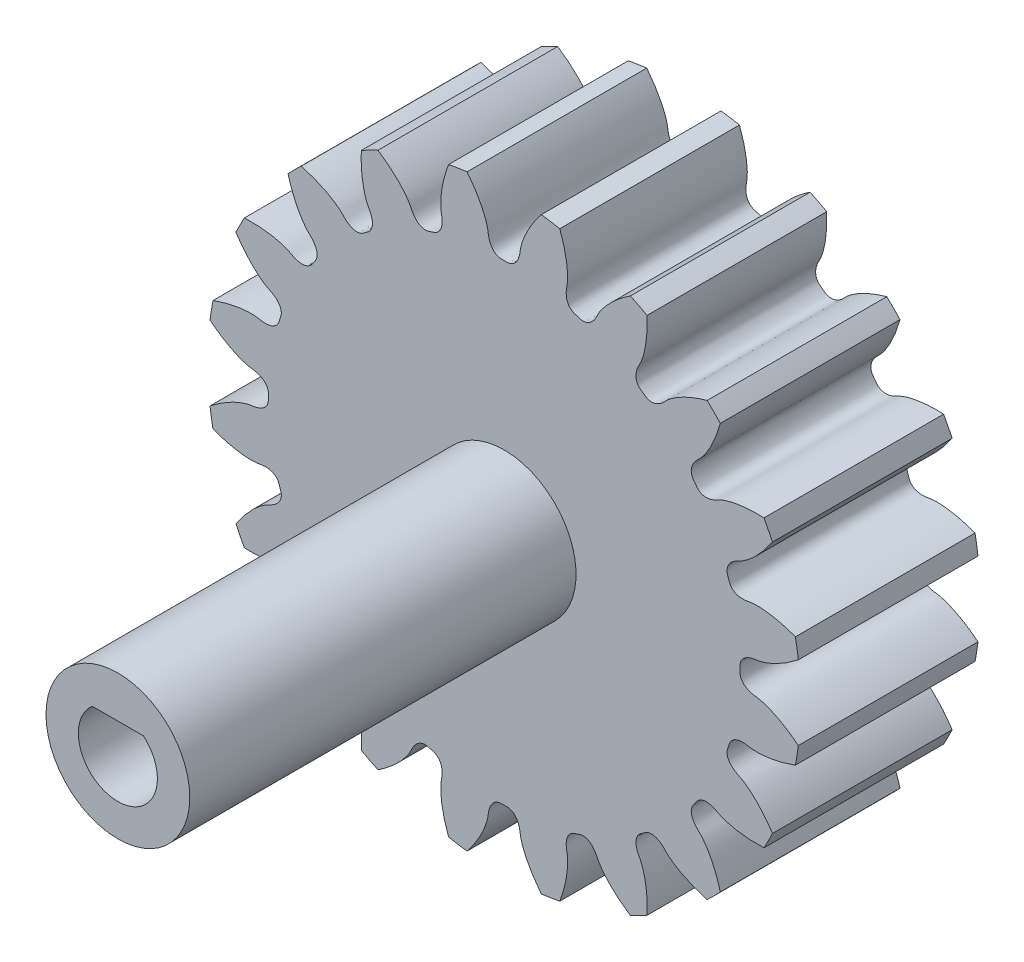
from build123d import *

# Parameters (mm, degrees)
SKETCHREVOLVESPURASSEMBLY01PINION_W       = 10
SKETCHREVOLVESPURASSEMBLY01PINION_H       = 16.499999752
TOOTHEXTRUDECUTSPURASSEMBLY01PINION_DEPTH = 5
PATTERNSPURASSEMBLY01PINION_COUNT         = 20
SKETCH1_R                                 = 4
BOSS_EXTRUDE1_DEPTH                       = 21.5
CUT_EXTRUDE5_DEPTH                        = 8
BOSS_EXTRUDE5_START                       = 5
SKETCH8_R                                 = 4
BOSS_EXTRUDE5_DEPTH                       = 5


with BuildPart() as part:
    # SketchRevolveSpurAssembly01Pinion → SpurAssembly01Pinion (revolve)
    with BuildSketch(Plane(origin=(0, 0, 0), x_dir=(0, 0, -1), z_dir=(1, 0, 0))):
        with Locations((0, 8.249999876)):
            Rectangle(SKETCHREVOLVESPURASSEMBLY01PINION_W, SKETCHREVOLVESPURASSEMBLY01PINION_H)
    revolve(axis=Axis((0, 0, 0), (0, 0, -1)))

    # SketchToothSpurAssembly01Pinion → ToothExtrudeCutSpurAssembly01Pinion (cut, symmetric)
    with BuildSketch(Plane.XY):
        with BuildLine():
            ThreePointArc((16.438815928, 2.120364973), (16.574999751, 0), (16.438815928, -2.120364973))
            add(Edge.make_bspline(
                [(16.438815928, -2.120364973), (16.306213447, -2.012632117), (16.10792267, -1.860929635), (15.841705586, -1.676668952), (15.654853966, -1.55570694), (15.475899367, -1.447553762), (15.305444286, -1.351598726), (15.144060802, -1.267206194), (14.992289617, -1.193717223), (14.850639167, -1.130450865), (14.719584807, -1.0767054), (14.599567969, -1.031760257), (14.490995634, -0.99487577), (14.394239041, -0.965299916), (14.309634999, -0.942253529), (14.237479548, -0.924980687), (14.178044201, -0.912608864), (14.049223501, -0.890261122), (13.912281496, -0.878231728), (13.769652297, -0.842658369), (13.695599357, -0.820644128), (13.624377747, -0.794966749), (13.555692175, -0.765356143), (13.489258635, -0.731124882), (13.424830796, -0.691333031), (13.362331646, -0.644635632), (13.30209452, -0.589245233), (13.24524803, -0.523019137), (13.194309632, -0.443877425), (13.153279262, -0.350864326), (13.130262908, -0.253354669), (13.120821868, -0.134969136), (13.12767395, 0), (13.120821868, 0.134969136), (13.130262908, 0.253354669), (13.153279262, 0.350864326), (13.194309632, 0.443877425), (13.24524803, 0.523019137), (13.30209452, 0.589245233), (13.362331646, 0.644635632), (13.424830796, 0.691333031), (13.489258635, 0.731124882), (13.555692175, 0.765356143), (13.624377747, 0.794966749), (13.695599357, 0.820644128), (13.769652297, 0.842658369), (13.912281496, 0.878231728), (14.049223501, 0.890261122), (14.178044201, 0.912608864), (14.237479548, 0.924980687), (14.309634999, 0.942253529), (14.394239041, 0.965299916), (14.490995634, 0.99487577), (14.599567969, 1.031760257), (14.719584807, 1.0767054), (14.850639167, 1.130450865), (14.992289617, 1.193717223), (15.144060802, 1.267206194), (15.305444286, 1.351598726), (15.475899367, 1.447553762), (15.654853966, 1.55570694), (15.841705586, 1.676668952), (16.10792267, 1.860929635), (16.306213447, 2.012632117), (16.438815928, 2.120364973)],
                knots=[0, 0, 0, 0, 0.061422842, 0.089709677, 0.116380121, 0.141434175, 0.164871838, 0.186693111, 0.206897994, 0.225486485, 0.242458587, 0.257814298, 0.271553618, 0.283676548, 0.294183087, 0.303073236, 0.310346995, 0.316004363, 0.350076802, 0.359567688, 0.36880314, 0.37784437, 0.386769007, 0.395675631, 0.404688756, 0.413962948, 0.423682731, 0.434051196, 0.445255861, 0.457401439, 0.47041984, 0.481066796, 0.5, 0.518933204, 0.52958016, 0.542598561, 0.554744139, 0.565948804, 0.576317269, 0.586037052, 0.595311244, 0.604324369, 0.613230993, 0.62215563, 0.63119686, 0.640432312, 0.649923198, 0.683995637, 0.689653005, 0.696926764, 0.705816913, 0.716323452, 0.728446382, 0.742185702, 0.757541413, 0.774513515, 0.793102006, 0.813306889, 0.835128162, 0.858565825, 0.883619879, 0.910290323, 0.938577158, 1, 1, 1, 1], degree=3))
        make_face()
    toothextrudecutspurassembly01pinion = extrude(amount=TOOTHEXTRUDECUTSPURASSEMBLY01PINION_DEPTH, both=True, mode=Mode.SUBTRACT)

    # PatternSpurAssembly01Pinion: ToothExtrudeCutSpurAssembly01Pinion ×20 about axis
    patternspurassembly01pinion_axis = Axis((0, 0, 55), (0, 0, -1))
    for i in range(1, PATTERNSPURASSEMBLY01PINION_COUNT):
        add(toothextrudecutspurassembly01pinion.rotate(patternspurassembly01pinion_axis, i * 360 / PATTERNSPURASSEMBLY01PINION_COUNT), mode=Mode.SUBTRACT)

    # Sketch1 → Boss-Extrude1 (add)
    with BuildSketch(Plane.XY.offset(5)):
        Circle(SKETCH1_R)
    extrude(amount=BOSS_EXTRUDE1_DEPTH)

    # Sketch7 → Cut-Extrude5 (cut)
    with BuildSketch(Plane.XY.offset(26.5)):
        with BuildLine():
            Line((1.420109873, 1.68026425), (-1.420109873, 1.68026425))
            ThreePointArc((-1.420109873, 1.68026425), (0, -2.2), (1.420109873, 1.68026425))
        make_face()
    extrude(amount=-CUT_EXTRUDE5_DEPTH, mode=Mode.SUBTRACT)

    # Sketch8 → Boss-Extrude5 (add)
    with BuildSketch(Plane(origin=(0, 0, -5), x_dir=(-1, 0, 0), z_dir=(0, 0, -1)).offset(BOSS_EXTRUDE5_START)):
        Circle(SKETCH8_R)
    extrude(amount=-BOSS_EXTRUDE5_DEPTH)


solid = part.part
